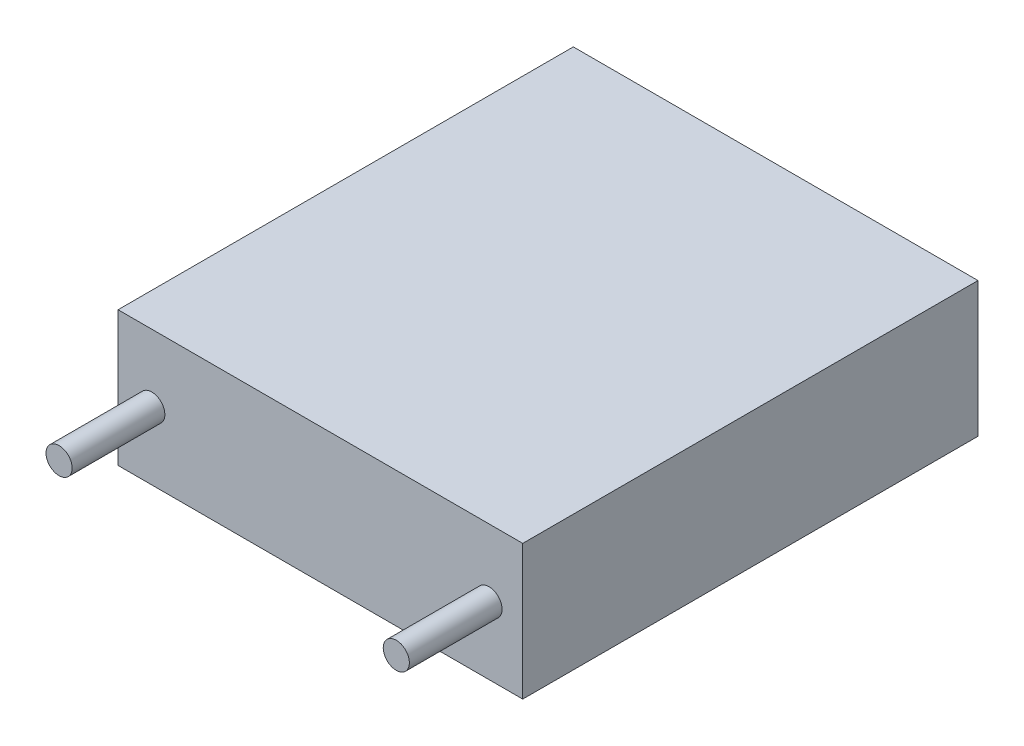
from build123d import *

# Parameters (mm, degrees)
SKETCH_1_W      = 24
SKETCH_1_H      = 8
EXTRUDE_1_DEPTH = 27
SKETCH_2_R      = 0.77457148
EXTRUDE_2_DEPTH = 5.5


with BuildPart() as part:
    # Эскиз1 → Вытянуть1 (new body)
    with BuildSketch(Plane.XY):
        with Locations((12, 4)):
            Rectangle(SKETCH_1_W, SKETCH_1_H)
    extrude(amount=EXTRUDE_1_DEPTH)

    # Эскиз2 → Вытянуть2 (add)
    with BuildSketch(Plane.XY.offset(27)):
        with Locations(Location((2, 4, 0), (0, 0, 180))):
            Circle(SKETCH_2_R)
        with Locations(Location((22, 4, 0), (0, 0, 180))):
            Circle(SKETCH_2_R)
    extrude(amount=EXTRUDE_2_DEPTH)


solid = part.part
